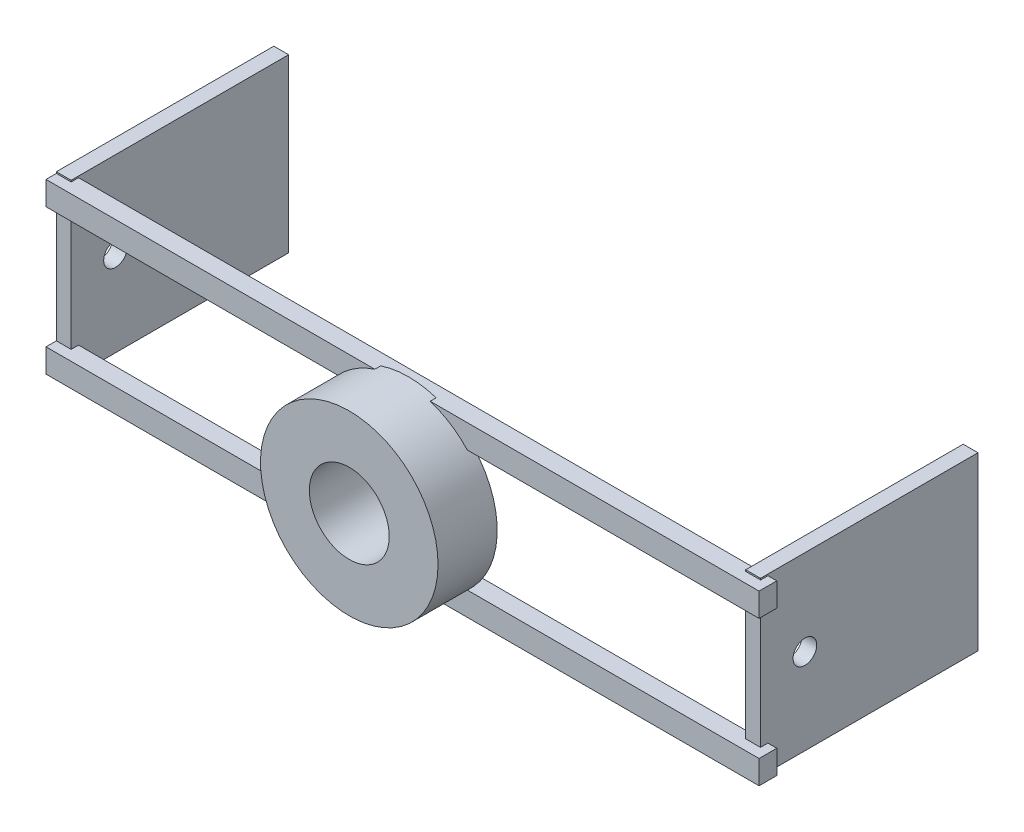
from build123d import *

# Parameters (mm, degrees)
SKETCH1_R           = 60
BOSS_EXTRUDE1_DEPTH = 40
SKETCH2_W           = 482
SKETCH2_H           = 16
BOSS_EXTRUDE2_DEPTH = 12
SKETCH3_W           = 482
SKETCH3_H           = 16
BOSS_EXTRUDE3_DEPTH = 12
SKETCH4_W           = 147
SKETCH4_H           = 116
BOSS_EXTRUDE4_DEPTH = 10
SKETCH5_W           = 147
SKETCH5_H           = 116
BOSS_EXTRUDE5_DEPTH = 10
SKETCH6_R           = 27
CUT_EXTRUDE1_DEPTH  = 210
SKETCH7_R           = 8
CUT_EXTRUDE2_DEPTH  = 502


with BuildPart() as part:
    # Sketch1 → Boss-Extrude1 (new body)
    with BuildSketch(Plane.XY.offset(190)):
        with Locations((300, 300)):
            Circle(SKETCH1_R)
    extrude(amount=BOSS_EXTRUDE1_DEPTH)

    # Sketch2 → Boss-Extrude2 (add)
    with BuildSketch(Plane.XY.offset(182)):
        with Locations((300, 349)):
            Rectangle(SKETCH2_W, SKETCH2_H)
    extrude(amount=BOSS_EXTRUDE2_DEPTH)

    # Sketch3 → Boss-Extrude3 (add)
    with BuildSketch(Plane.XY.offset(182)):
        with Locations((300, 251)):
            Rectangle(SKETCH3_W, SKETCH3_H)
    extrude(amount=BOSS_EXTRUDE3_DEPTH)

    # Sketch4 → Boss-Extrude4 (add)
    with BuildSketch(Plane(origin=(525, 0, 0), x_dir=(0, 0, -1), z_dir=(1, 0, 0))):
        with Locations((-113.5, 300)):
            Rectangle(SKETCH4_W, SKETCH4_H)
    extrude(amount=BOSS_EXTRUDE4_DEPTH)

    # Sketch5 → Boss-Extrude5 (add)
    with BuildSketch(Plane(origin=(59, 0, 0), x_dir=(0, 0, -1), z_dir=(1, 0, 0))):
        with Locations((-113.5, 300)):
            Rectangle(SKETCH5_W, SKETCH5_H)
    extrude(amount=BOSS_EXTRUDE5_DEPTH)

    # Sketch6 → Cut-Extrude1 (cut)
    with BuildSketch(Plane.XY.offset(230)):
        with Locations((300, 300)):
            Circle(SKETCH6_R)
    extrude(amount=-CUT_EXTRUDE1_DEPTH, mode=Mode.SUBTRACT)

    # Sketch7 → Cut-Extrude2 (cut)
    with BuildSketch(Plane(origin=(535, 0, 0), x_dir=(0, 0, -1), z_dir=(1, 0, 0))):
        with Locations((-157, 300)):
            Circle(SKETCH7_R)
    extrude(amount=-CUT_EXTRUDE2_DEPTH, mode=Mode.SUBTRACT)


solid = part.part
